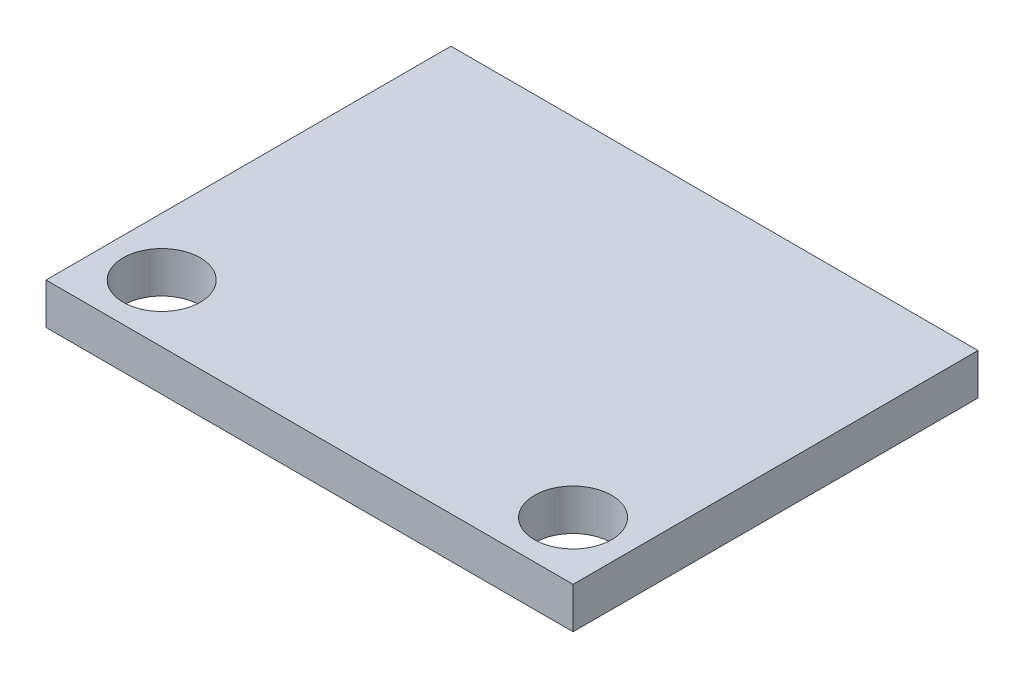
from build123d import *

# Parameters (mm, degrees)
SKETCH1_W           = 20.5
SKETCH1_H           = 15.75
SKETCH1_R           = 1.5
BOSS_EXTRUDE1_DEPTH = 1.6


with BuildPart() as part:
    # Sketch1 → Boss-Extrude1 (new body)
    with BuildSketch(Plane(origin=(0, 0, 0), x_dir=(1, 0, 0), z_dir=(0, 1, 0))):
        Rectangle(SKETCH1_W, SKETCH1_H)
        with Locations(Location((8, -5.625, 0), (0, 0, 270))):
            Circle(SKETCH1_R, mode=Mode.SUBTRACT)
        with Locations(Location((-8, -5.625, 0), (0, 0, 90))):
            Circle(SKETCH1_R, mode=Mode.SUBTRACT)
    extrude(amount=BOSS_EXTRUDE1_DEPTH)


solid = part.part
